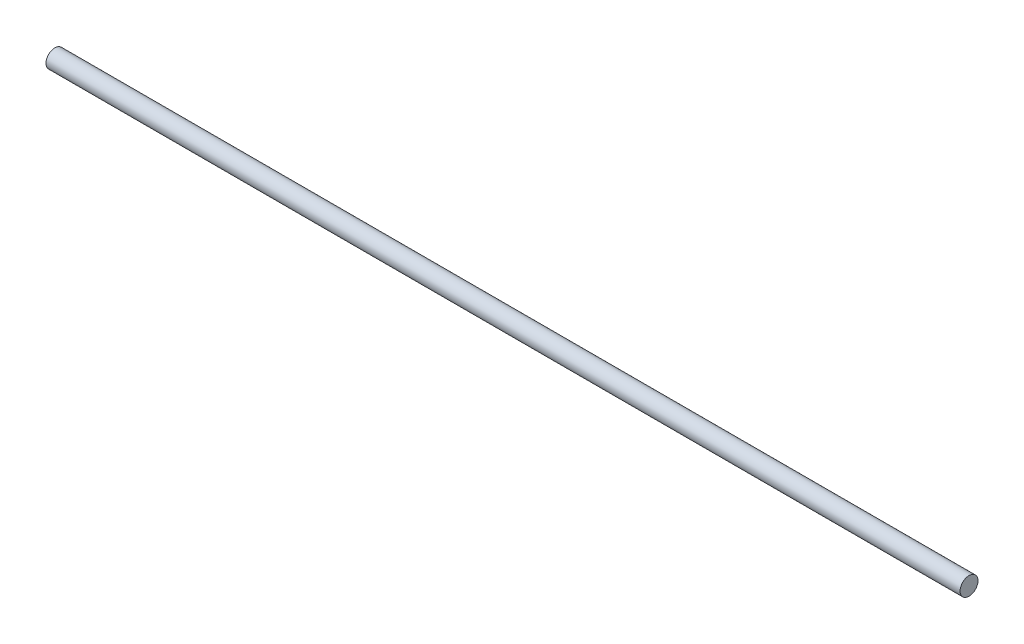
from build123d import *

# Parameters (mm, degrees)
SKETCH1_R           = 5
BOSS_EXTRUDE1_DEPTH = 510


with BuildPart() as part:
    # Sketch1 → Boss-Extrude1 (new body)
    with BuildSketch(Plane(origin=(0, 0, 0), x_dir=(0, 0, -1), z_dir=(1, 0, 0))):
        Circle(SKETCH1_R)
    extrude(amount=BOSS_EXTRUDE1_DEPTH)


solid = part.part
